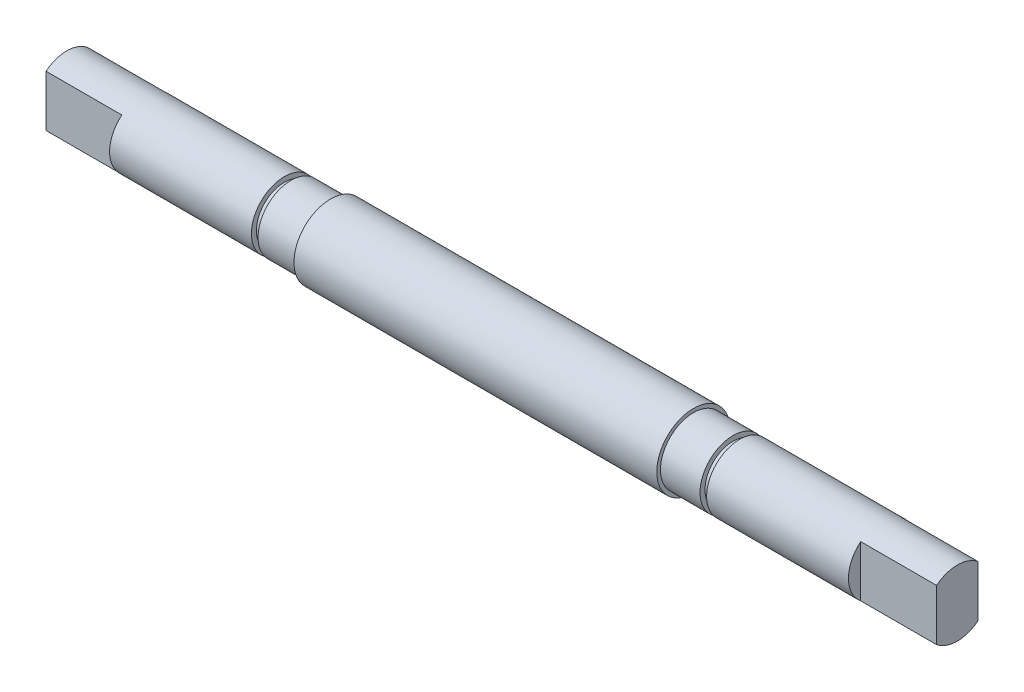
from build123d import *

# Parameters (mm, degrees)
CORTAR_EXTRUIR1_START = -23
CORTAR_EXTRUIR1_DEPTH = 23


with BuildPart() as part:
    # Croquis1 → Revolución1 (revolve)
    with BuildSketch(Plane.XY, mode=Mode.PRIVATE) as revoluci_n1_sk:
        Polygon((13.505191192, 11.1125), (68.505191192, 11.1125), (68.505191192, 0), (-66.494808808, 0), (-66.494808808, 10), (-0.494808808, 10), (-0.494808808, 8.5), (1.505191192, 8.5), (1.505191192, 10), (13.505191192, 10), align=None)
    revoluci_n1 = revolve(revoluci_n1_sk.sketch.rotate(Axis((70.414965315, 0, 0), (-1, 0, 0)), 90), axis=Axis((70.414965315, 0, 0), (-1, 0, 0)))

    # Croquis2 → Cortar-Extruir1 (cut)
    with BuildSketch(Plane.ZY.offset(66.494808808).offset(CORTAR_EXTRUIR1_START)):
        with BuildLine():
            Line((-6.278365003, -7.783452504), (-6.278365003, 7.783452504))
            ThreePointArc((-6.278365003, 7.783452504), (-10, 0), (-6.278365003, -7.783452504))
        make_face()
        with BuildLine():
            Line((6.278365003, -7.783452504), (6.278365003, 7.783452504))
            ThreePointArc((6.278365003, 7.783452504), (10, 0), (6.278365003, -7.783452504))
        make_face()
    cortar_extruir1 = extrude(amount=CORTAR_EXTRUIR1_DEPTH, mode=Mode.SUBTRACT)

    # Simetría2: Revolución1, Cortar-Extruir1 across plane
    add(revoluci_n1.mirror(Plane(origin=(68.505191192, 11.1125, 0), x_dir=(0, 0, 1), z_dir=(1, 0, 0))))
    add(cortar_extruir1.mirror(Plane(origin=(68.505191192, 11.1125, 0), x_dir=(0, 0, 1), z_dir=(1, 0, 0))), mode=Mode.SUBTRACT)


solid = part.part
